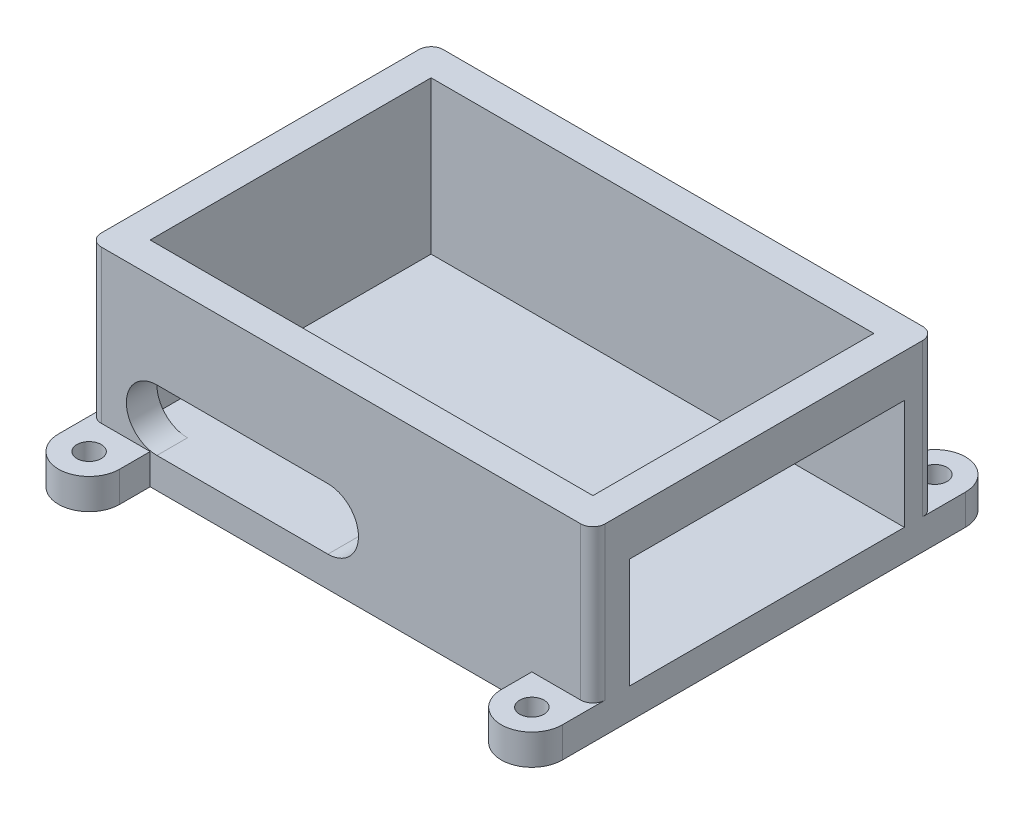
from build123d import *

# Parameters (mm, degrees)
SKETCH1_W           = 104.775
SKETCH1_H           = 71.12
BOSS_EXTRUDE1_DEPTH = 6.35
SKETCH1_3_W         = 104.775
SKETCH1_3_H         = 71.12
SKETCH1_3_W_2       = 92.075
SKETCH1_3_H_2       = 58.42
BOSS_EXTRUDE2_DEPTH = 38.1
CUT_EXTRUDE1_REACH  = 98.198
CUT_EXTRUDE2_REACH  = 119.021
SKETCH3_W           = 57.15
SKETCH3_H           = 22.86
BOSS_EXTRUDE3_DEPTH = 6.35
CUT_EXTRUDE3_REACH  = 79.984
SKETCH5_R           = 2.54
FILLET1_R           = 2.54


with BuildPart() as part:
    # Sketch1 → Boss-Extrude1 (new body)
    with BuildSketch(Plane(origin=(0, 0, 0), x_dir=(1, 0, 0), z_dir=(0, 1, 0))):
        Rectangle(SKETCH1_W, SKETCH1_H)
    extrude(amount=BOSS_EXTRUDE1_DEPTH)

    # Sketch1<3> → Boss-Extrude2 (add)
    with BuildSketch(Plane(origin=(0, 0, 0), x_dir=(1, 0, 0), z_dir=(0, 1, 0))):
        Rectangle(SKETCH1_3_W, SKETCH1_3_H)
        Rectangle(SKETCH1_3_W_2, SKETCH1_3_H_2, mode=Mode.SUBTRACT)
    extrude(amount=BOSS_EXTRUDE2_DEPTH)

    # Sketch2 → Cut-Extrude1 (cut, up to next)
    with BuildSketch(Plane.XY.offset(35.56), mode=Mode.PRIVATE) as cut_extrude1_sk1:
        with BuildLine():
            Line((-38.283663242, 19.05), (-2.723663242, 19.05))
            ThreePointArc((-2.723663242, 19.05), (3.626336758, 12.7), (-2.723663242, 6.35))
            Line((-2.723663242, 6.35), (-38.283663242, 6.35))
            ThreePointArc((-38.283663242, 6.35), (-44.633663242, 12.7), (-38.283663242, 19.05))
        make_face()
    cut_extrude1_tool1 = extrude(cut_extrude1_sk1.sketch, amount=-CUT_EXTRUDE1_REACH, mode=Mode.PRIVATE) & part.part
    add(cut_extrude1_tool1.solids().sort_by_distance((-20.503663, 12.7, 35.56))[0], mode=Mode.SUBTRACT)

    # Sketch3 → Cut-Extrude2 (cut, up to next)
    with BuildSketch(Plane(origin=(52.3875, 0, 0), x_dir=(0, 0, -1), z_dir=(1, 0, 0)), mode=Mode.PRIVATE) as cut_extrude2_sk1:
        with Locations((0.635, 17.78)):
            Rectangle(SKETCH3_W, SKETCH3_H)
    cut_extrude2_tool1 = extrude(cut_extrude2_sk1.sketch, amount=-CUT_EXTRUDE2_REACH, mode=Mode.PRIVATE) & part.part
    add(cut_extrude2_tool1.solids().sort_by_distance((52.3875, 17.78, -0.635))[0], mode=Mode.SUBTRACT)

    # Sketch4 → Boss-Extrude3 (add)
    with BuildSketch(Plane.XZ):
        with BuildLine():
            Line((-39.6875, 41.91), (-39.6875, 35.56))
            Line((-39.6875, 35.56), (-52.3875, 35.56))
            Line((-52.3875, 35.56), (-52.3875, 41.91))
            ThreePointArc((-52.3875, 41.91), (-46.0375, 48.26), (-39.6875, 41.91))
        make_face()
        with BuildLine():
            Line((39.6875, 41.91), (39.6875, 35.56))
            Line((39.6875, 35.56), (52.3875, 35.56))
            Line((52.3875, 35.56), (52.3875, 41.91))
            ThreePointArc((52.3875, 41.91), (46.0375, 48.26), (39.6875, 41.91))
        make_face()
        with BuildLine():
            Line((-52.3875, -41.91), (-52.3875, -35.56))
            Line((-52.3875, -35.56), (-39.6875, -35.56))
            Line((-39.6875, -35.56), (-39.6875, -41.91))
            ThreePointArc((-39.6875, -41.91), (-46.0375, -48.26), (-52.3875, -41.91))
        make_face()
        with BuildLine():
            Line((39.6875, -41.91), (39.6875, -35.56))
            Line((39.6875, -35.56), (52.3875, -35.56))
            Line((52.3875, -35.56), (52.3875, -41.91))
            ThreePointArc((52.3875, -41.91), (46.0375, -48.26), (39.6875, -41.91))
        make_face()
    extrude(amount=-BOSS_EXTRUDE3_DEPTH)

    # Sketch5 → Cut-Extrude3 (cut, up to next)
    with BuildSketch(Plane(origin=(0, 6.35, 0), x_dir=(1, 0, 0), z_dir=(0, 1, 0)), mode=Mode.PRIVATE) as cut_extrude3_sk1:
        with Locations((-46.0375, 41.91)):
            Circle(SKETCH5_R)
    cut_extrude3_tool1 = extrude(cut_extrude3_sk1.sketch, amount=-CUT_EXTRUDE3_REACH, mode=Mode.PRIVATE) & part.part
    # Sketch5 → Cut-Extrude3 (cut, up to next)
    with BuildSketch(Plane(origin=(0, 6.35, 0), x_dir=(1, 0, 0), z_dir=(0, 1, 0)), mode=Mode.PRIVATE) as cut_extrude3_sk2:
        with Locations((46.0375, 41.91)):
            Circle(SKETCH5_R)
    cut_extrude3_tool2 = extrude(cut_extrude3_sk2.sketch, amount=-CUT_EXTRUDE3_REACH, mode=Mode.PRIVATE) & part.part
    # Sketch5 → Cut-Extrude3 (cut, up to next)
    with BuildSketch(Plane(origin=(0, 6.35, 0), x_dir=(1, 0, 0), z_dir=(0, 1, 0)), mode=Mode.PRIVATE) as cut_extrude3_sk3:
        with Locations((46.0375, -41.91)):
            Circle(SKETCH5_R)
    cut_extrude3_tool3 = extrude(cut_extrude3_sk3.sketch, amount=-CUT_EXTRUDE3_REACH, mode=Mode.PRIVATE) & part.part
    # Sketch5 → Cut-Extrude3 (cut, up to next)
    with BuildSketch(Plane(origin=(0, 6.35, 0), x_dir=(1, 0, 0), z_dir=(0, 1, 0)), mode=Mode.PRIVATE) as cut_extrude3_sk4:
        with Locations((-46.0375, -41.91)):
            Circle(SKETCH5_R)
    cut_extrude3_tool4 = extrude(cut_extrude3_sk4.sketch, amount=-CUT_EXTRUDE3_REACH, mode=Mode.PRIVATE) & part.part
    add(cut_extrude3_tool1.solids().sort_by_distance((-46.0375, 6.35, -41.91))[0], mode=Mode.SUBTRACT)
    add(cut_extrude3_tool2.solids().sort_by_distance((46.0375, 6.35, -41.91))[0], mode=Mode.SUBTRACT)
    add(cut_extrude3_tool3.solids().sort_by_distance((46.0375, 6.35, 41.91))[0], mode=Mode.SUBTRACT)
    add(cut_extrude3_tool4.solids().sort_by_distance((-46.0375, 6.35, 41.91))[0], mode=Mode.SUBTRACT)

    # Fillet1
    fillet1_edges = [part.edges().sort_by_distance(p)[0] for p in [
        (52.3875, 22.225, -35.56),
        (52.3875, 22.225, 35.56),
        (-52.3875, 22.225, -35.56),
        (-52.3875, 22.225, 35.56),
    ]]
    fillet(fillet1_edges, radius=FILLET1_R)


solid = part.part
